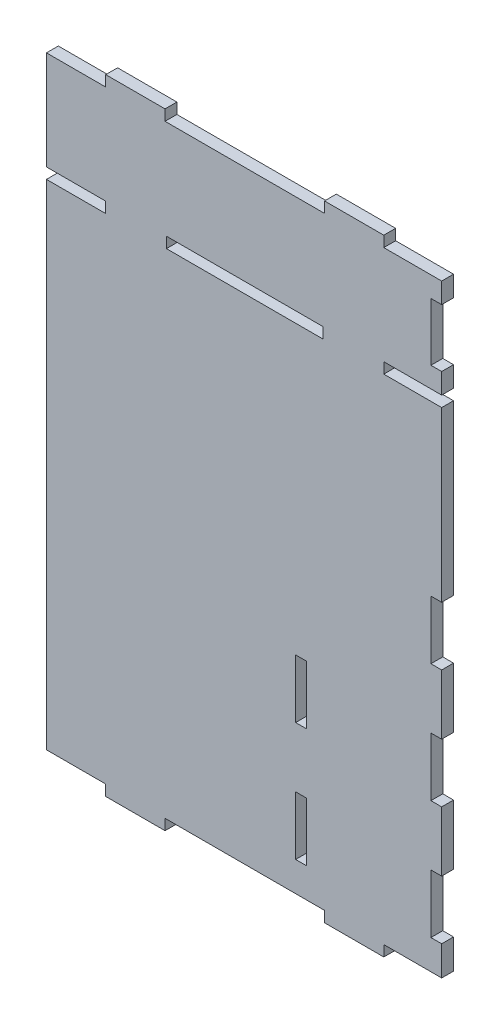
from build123d import *

# Parameters (mm, degrees)
SKETCH_2_W      = 79.3
SKETCH_2_H      = 5.45
SKETCH_2_W_2    = 5.45
SKETCH_2_H_2    = 29.65
EXTRUDE_1_DEPTH = 6


with BuildPart() as part:
    # Эскиз2 → Бобышка-Вытянуть1 (new body)
    with BuildSketch(Plane.XY):
        Polygon((0, 0), (-29.3, 0), (-29.3, 5.45), (0, 5.45), (0, 15.8), (-5.45, 15.8), (-5.45, 45.1), (0, 45.1), (0, 55.45), (-29.3, 55.45), (-29.3, 60.9), (-59.3, 60.9), (-59.3, 55.45), (-140, 55.45), (-140, 60.9), (-170, 60.9), (-170, 55.45), (-200, 55.45), (-200, 5.45), (-170, 5.45), (-170, 0), (-200, 0), (-200, -250), (-170, -250), (-170, -255.45), (-140, -255.45), (-140, -250), (-59.3, -250), (-59.3, -255.45), (-29.3, -255.45), (-29.3, -250), (0, -250), (0, -235), (-5.45, -235), (-5.45, -205.35), (0, -205.35), (0, -175), (-5.45, -175), (-5.45, -145.35), (0, -145.35), (0, -115), (-5.45, -115), (-5.45, -85.35), (0, -85.35), align=None)
        with Locations((-99.65, 2.725)):
            Rectangle(SKETCH_2_W, SKETCH_2_H, mode=Mode.SUBTRACT)
        with Locations((-71.175, -220.175)):
            Rectangle(SKETCH_2_W_2, SKETCH_2_H_2, mode=Mode.SUBTRACT)
        with Locations((-71.175, -160.175)):
            Rectangle(SKETCH_2_W_2, SKETCH_2_H_2, mode=Mode.SUBTRACT)
    extrude(amount=EXTRUDE_1_DEPTH)


solid = part.part
